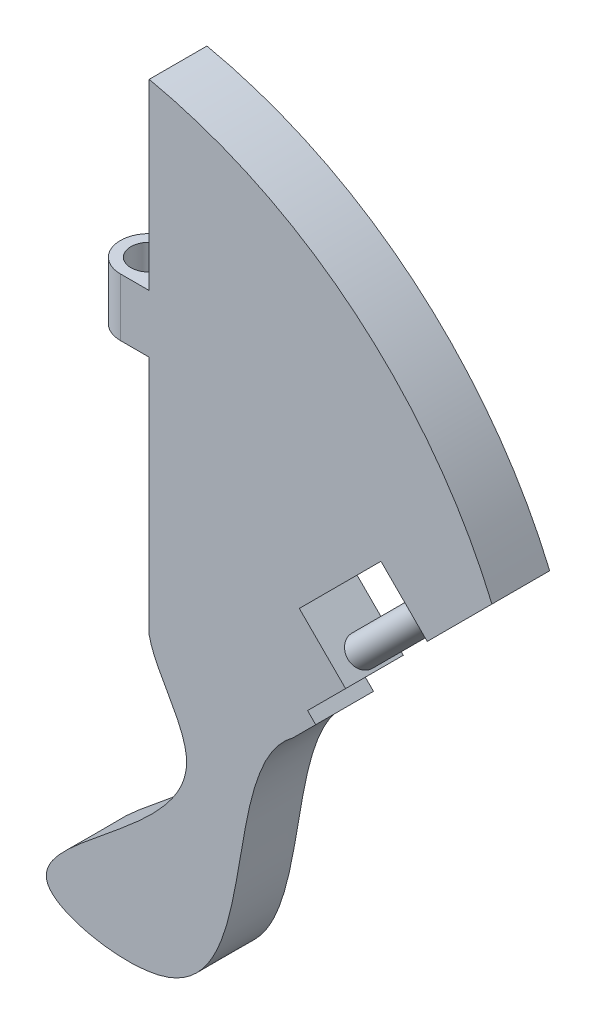
from build123d import *

# Parameters (mm, degrees)
SALIENTE_EXTRUIR1_DEPTH = 6
SALIENTE_EXTRUIR2_START = 25
SALIENTE_EXTRUIR2_DEPTH = 6
CROQUIS3_R              = 1.9
CORTAR_EXTRUIR1_DEPTH   = 6
CORTAR_EXTRUIR3_DEPTH   = 6
SALIENTE_EXTRUIR3_REACH = 51.703
CROQUIS5_R              = 1.5
CORTAR_EXTRUIR4_DEPTH   = 10


with BuildPart() as part:
    # Croquis1 → Saliente-Extruir1 (new body)
    with BuildSketch(Plane.XY):
        with BuildLine():
            Line((0, 0), (0, 50))
            ThreePointArc((0, 50), (21.903219132, 39.234474721), (36.101178055, 19.383391493))
            Line((36.101178055, 19.383391493), (14.887974619, -1.829811942))
            add(Edge.make_bspline(
                [(0, 0), (0.623539066, -3.01124013), (11.292529233, -13.692033377), (-21.600358358, -27.488804853), (13.990569908, -34.415293016), (6.990460956, -7.615408786), (14.887974619, -1.829811942)],
                knots=[0, 0, 0, 0, 0.133846332, 0.436860552, 0.593183307, 1, 1, 1, 1], degree=3))
        make_face()
    extrude(amount=SALIENTE_EXTRUIR1_DEPTH)

    # Croquis2 → Saliente-Extruir2 (add)
    with BuildSketch(Plane(origin=(0, 0, 0), x_dir=(1, 0, 0), z_dir=(0, 1, 0)).offset(SALIENTE_EXTRUIR2_START)):
        with BuildLine():
            Line((0, 0), (-3, 0))
            ThreePointArc((-3, 0), (-6, -3), (-3, -6))
            Line((-3, -6), (0, -6))
            Line((0, -6), (0, 0))
        make_face()
    extrude(amount=SALIENTE_EXTRUIR2_DEPTH)

    # Croquis3 → Cortar-Extruir1 (cut)
    with BuildSketch(Plane(origin=(0, 31, 0), x_dir=(1, 0, 0), z_dir=(0, 1, 0))):
        with Locations(Location((-3, -3, 0), (0, 0, 270))):
            Circle(CROQUIS3_R)
    extrude(amount=-CORTAR_EXTRUIR1_DEPTH, mode=Mode.SUBTRACT)

    # Croquis4 → Cortar-Extruir3 (cut)
    with BuildSketch(Plane(origin=(0, 0, 0), x_dir=(-1, 0, 0), z_dir=(0, 0, -1))):
        Polygon((-29.737217024, 13.019430463), (-24.080362774, 18.676284712), (-15.5950814, 10.191003338), (-21.25193565, 4.534149088), align=None)
    extrude(amount=-CORTAR_EXTRUIR3_DEPTH, mode=Mode.SUBTRACT)

    # Croquis5 → Saliente-Extruir3 (add, up to next)
    with BuildSketch(Plane(origin=(12.893042369, 12.893042369, 0), x_dir=(0, 0, -1), z_dir=(0.7071067811865479, 0.7071067811865472, 0)), mode=Mode.PRIVATE) as saliente_extruir3_sk1:
        with Locations(Location((-3, -8.821260244, 0), (0, 0, 270))):
            Circle(CROQUIS5_R)
    saliente_extruir3_tool1 = extrude(saliente_extruir3_sk1.sketch, amount=SALIENTE_EXTRUIR3_REACH, mode=Mode.PRIVATE) - part.part
    add(saliente_extruir3_tool1.solids().sort_by_distance((19.130615, 6.655469, 3))[0])

    # Croquis6 → Cortar-Extruir4 (cut)
    with BuildSketch(Plane.XY.offset(6)):
        Polygon((36.101178055, 19.383391493), (17.302740572, 0.58495401), (16.454212434, 1.433482148), (35.609462094, 20.588731807), align=None)
    extrude(amount=-CORTAR_EXTRUIR4_DEPTH, mode=Mode.SUBTRACT)


with BuildPart() as cortar_extruir4_kept_piece:
    # of the separate pieces the step leaves, the one the design keeps (cortar_extruir4_pieces_kept)
    add(part.part.solids().sort_by_distance((0, 31, 0))[0])


solid = cortar_extruir4_kept_piece.part
